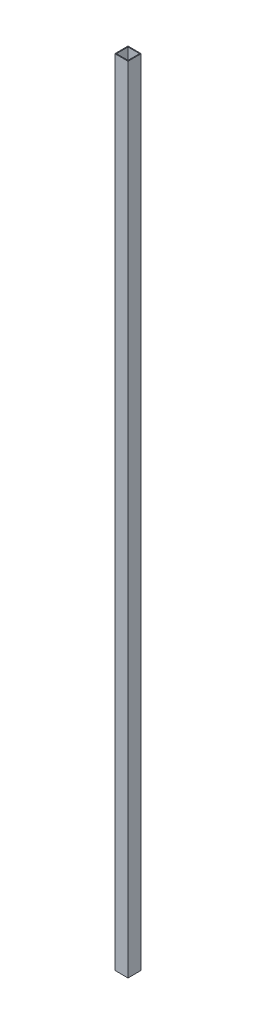
from build123d import *

# Parameters (mm, degrees)
SKETCH1_W           = 50.8
SKETCH1_H           = 50.8
SKETCH1_W_2         = 44.45
SKETCH1_H_2         = 44.45
BOSS_EXTRUDE1_DEPTH = 3048


with BuildPart() as part:
    # Sketch1 → Boss-Extrude1 (new body)
    with BuildSketch(Plane(origin=(0, 0, 0), x_dir=(1, 0, 0), z_dir=(0, 1, 0))):
        Rectangle(SKETCH1_W, SKETCH1_H)
        Rectangle(SKETCH1_W_2, SKETCH1_H_2, mode=Mode.SUBTRACT)
    extrude(amount=BOSS_EXTRUDE1_DEPTH)


solid = part.part
